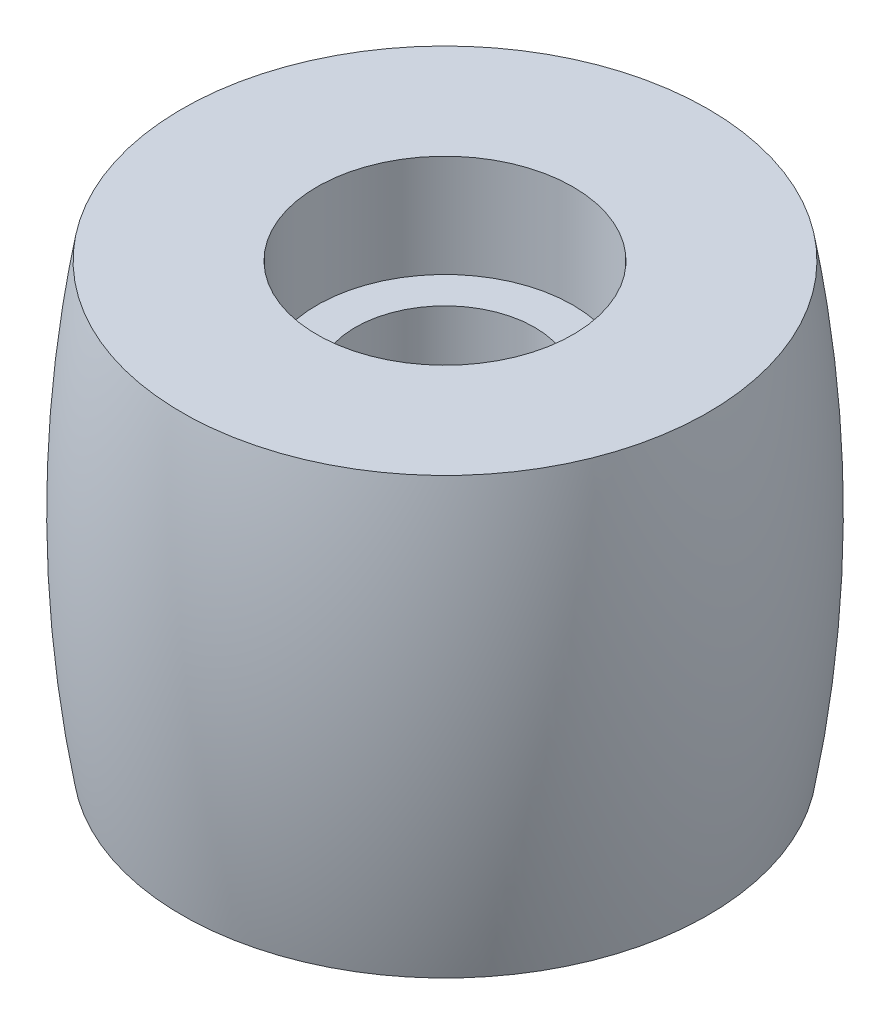
from build123d import *


with BuildPart() as part:
    # Sketch1 → Revolve1 (revolve)
    with BuildSketch(Plane.XY, mode=Mode.PRIVATE) as revolve1_sk:
        with BuildLine():
            Line((3.5, -4.5), (3.5, 4.5))
            Line((3.5, 4.5), (5, 4.5))
            Line((5, 4.5), (5, 8.5))
            Line((5, 8.5), (10.272203117, 8.5))
            ThreePointArc((10.272203117, 8.5), (11, 0), (10.272203117, -8.5))
            Line((10.272203117, -8.5), (5, -8.5))
            Line((5, -8.5), (5, -4.5))
            Line((5, -4.5), (3.5, -4.5))
        make_face()
    revolve(revolve1_sk.sketch.rotate(Axis((0, -169.064981061, 0), (0, 1, 0)), 90), axis=Axis((0, -169.064981061, 0), (0, 1, 0)))


solid = part.part
